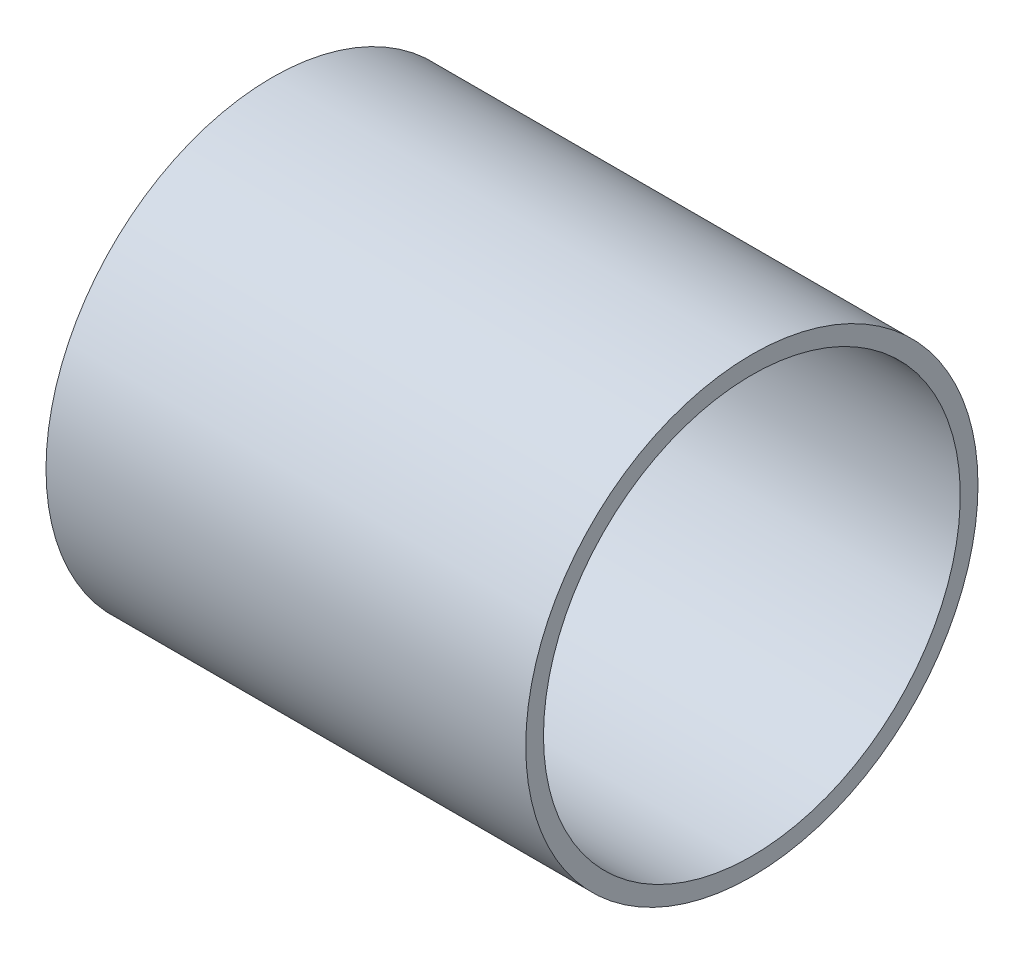
from build123d import *

# Parameters (mm, degrees)
SKETCH1_W = 33.6804
SKETCH1_H = 1.2446


with BuildPart() as part:
    # Sketch1 → Revolve1 (revolve)
    with BuildSketch(Plane(origin=(0, 0, 0), x_dir=(1, 0, 0), z_dir=(0, 1, 0)), mode=Mode.PRIVATE) as revolve1_sk:
        with Locations((0, 15.2527)):
            Rectangle(SKETCH1_W, SKETCH1_H)
    revolve(revolve1_sk.sketch.rotate(Axis((-72.893991897, 0, 0), (1, 0, 0)), 180), axis=Axis((-72.893991897, 0, 0), (1, 0, 0)))


solid = part.part
